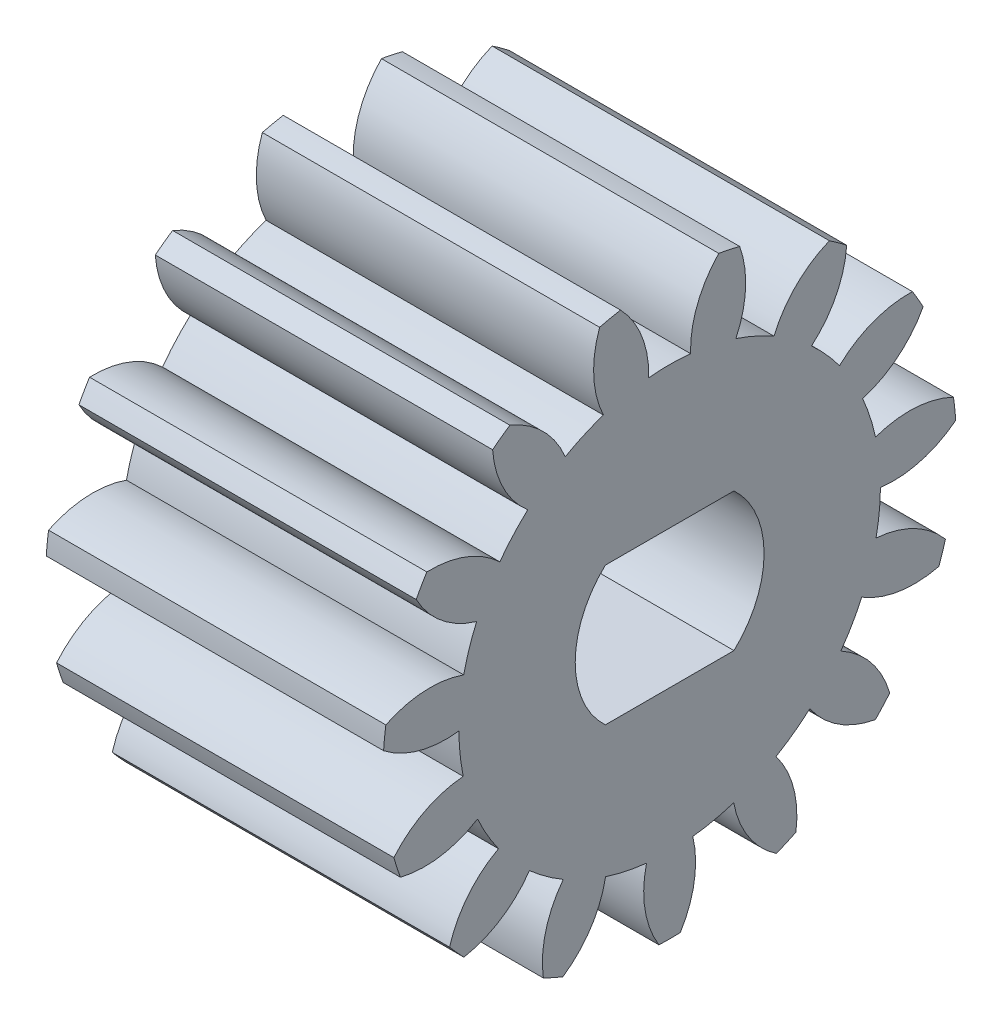
from build123d import *

# Parameters (mm, degrees)
BASPROSKE_W         = 10
BASPROSKE_H         = 8.5
TOOTHCUT_DEPTH      = 16.636495771
TEETHCUTS_COUNT     = 15
TEETHCUTS_ANGLE     = 336
BORSKE_R            = 2.5
BORE_DEPTH          = 50.0000508
BOSS_EXTRUDE1_DEPTH = 10
CUT_EXTRUDE1_DEPTH  = 10


with BuildPart() as part:
    # BasProSke → Base-Revolve (revolve)
    with BuildSketch(Plane(origin=(0, 0, 0), x_dir=(1, 0, 0), z_dir=(0, 1, 0)), mode=Mode.PRIVATE) as base_revolve_sk:
        with Locations((5, 4.25)):
            Rectangle(BASPROSKE_W, BASPROSKE_H)
    revolve(base_revolve_sk.sketch.rotate(Axis((-10, 0, 0), (1, 0, 0)), 180), axis=Axis((-10, 0, 0), (1, 0, 0)))

    # TooCutSke → ToothCut (cut, through all)
    with BuildSketch(Plane(origin=(0, 0, 0), x_dir=(0, 0, -1), z_dir=(1, 0, 0))):
        with BuildLine():
            ThreePointArc((0.619547138, 6.21821215), (0, 6.249), (-0.619547138, 6.21821215))
            ThreePointArc((-0.619547138, 6.21821215), (-0.827197364, 7.394441061), (-1.477319646, 8.396426134))
            ThreePointArc((-1.477319646, 8.396426134), (0, 8.5254), (1.477319646, 8.396426134))
            ThreePointArc((1.477319646, 8.396426134), (0.827197364, 7.394441061), (0.619547138, 6.21821215))
        make_face()
    toothcut = extrude(amount=TOOTHCUT_DEPTH, mode=Mode.SUBTRACT)

    # TeethCuts: ToothCut ×15 about axis
    teethcuts_axis = Axis((-10, 0, 0), (1, 0, 0))
    for i in range(1, TEETHCUTS_COUNT):
        add(toothcut.rotate(teethcuts_axis, i * TEETHCUTS_ANGLE / (TEETHCUTS_COUNT - 1)), mode=Mode.SUBTRACT)

    # BorSke → Bore (cut, symmetric)
    with BuildSketch(Plane(origin=(0, 0, 0), x_dir=(0, 0, -1), z_dir=(1, 0, 0))):
        with Locations(Location((0, 0, 0), (0, 0, 180))):
            Circle(BORSKE_R)
    extrude(amount=BORE_DEPTH, both=True, mode=Mode.SUBTRACT)

    # Sketch1 → Boss-Extrude1 (add, through all)
    with BuildSketch(Plane(origin=(10, 0, 0), x_dir=(0, 0, -1), z_dir=(1, 0, 0))):
        with BuildLine():
            ThreePointArc((1.907223112, 2.05), (0, 2.8), (-1.907223112, 2.05))
            Line((-1.907223112, 2.05), (1.907223112, 2.05))
        make_face()
        with BuildLine():
            Line((1.907223112, -2.05), (-1.907223112, -2.05))
            ThreePointArc((-1.907223112, -2.05), (0, -2.8), (1.907223112, -2.05))
        make_face()
    extrude(amount=-BOSS_EXTRUDE1_DEPTH)

    # Sketch1<3> → Cut-Extrude1 (cut)
    with BuildSketch(Plane(origin=(10, 0, 0), x_dir=(0, 0, -1), z_dir=(1, 0, 0))):
        with BuildLine():
            Line((1.907223112, 2.05), (-1.907223112, 2.05))
            ThreePointArc((-1.907223112, 2.05), (-2.8, 0), (-1.907223112, -2.05))
            Line((-1.907223112, -2.05), (1.907223112, -2.05))
            ThreePointArc((1.907223112, -2.05), (2.567121415, -1.11798374), (2.8, 0))
            ThreePointArc((2.8, 0), (2.567121415, 1.11798374), (1.907223112, 2.05))
        make_face()
    extrude(amount=-CUT_EXTRUDE1_DEPTH, mode=Mode.SUBTRACT)


solid = part.part
